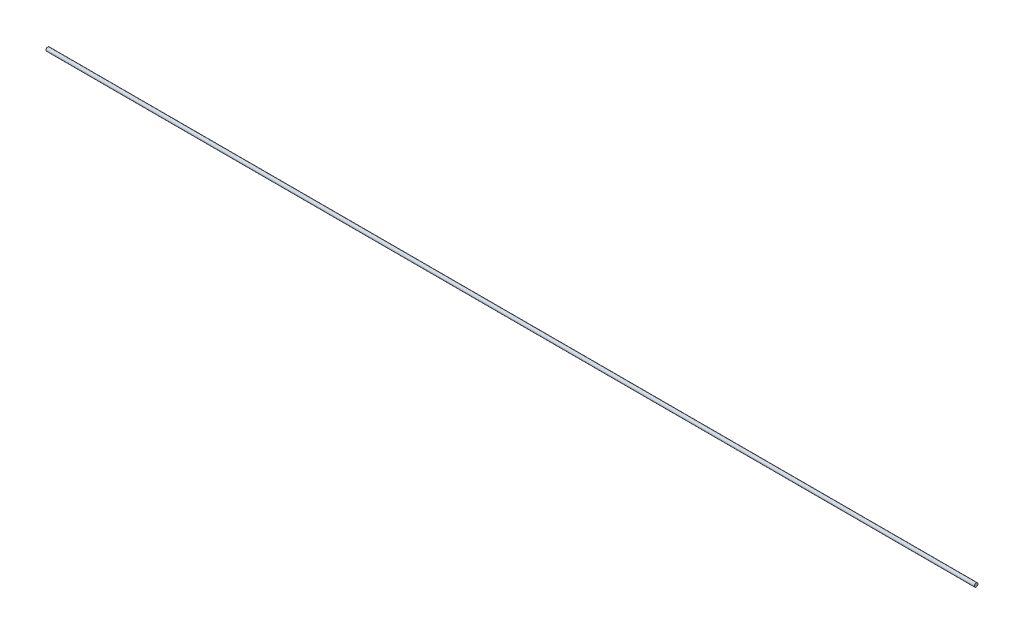
from build123d import *

# Parameters (mm, degrees)
SKETCH10_R          = 0.79375
BOSS_EXTRUDE3_DEPTH = 300.4
CHAMFER1_SIZE       = 0.15875
SKETCH13_R          = 1.981721066
CUT_EXTRUDE4_DEPTH  = 198.12


with BuildPart() as part:
    # Sketch10 → Boss-Extrude3 (new, symmetric)
    with BuildSketch(Plane(origin=(0, 0, 0), x_dir=(0, 0, -1), z_dir=(1, 0, 0))):
        Circle(SKETCH10_R)
    extrude(amount=BOSS_EXTRUDE3_DEPTH, both=True)

    # Chamfer1
    chamfer1_edges = [part.edges().sort_by_distance(p)[0] for p in [
        (-300.4, 0, 0.79375),
        (300.4, 0, 0.79375),
    ]]
    chamfer(chamfer1_edges, length=CHAMFER1_SIZE)

    # Sketch13 → Cut-Extrude4 (cut)
    with BuildSketch(Plane(origin=(300.4, 0, 0), x_dir=(0, 0, -1), z_dir=(1, 0, 0))):
        Circle(SKETCH13_R)
    extrude(amount=-CUT_EXTRUDE4_DEPTH, mode=Mode.SUBTRACT)


solid = part.part
